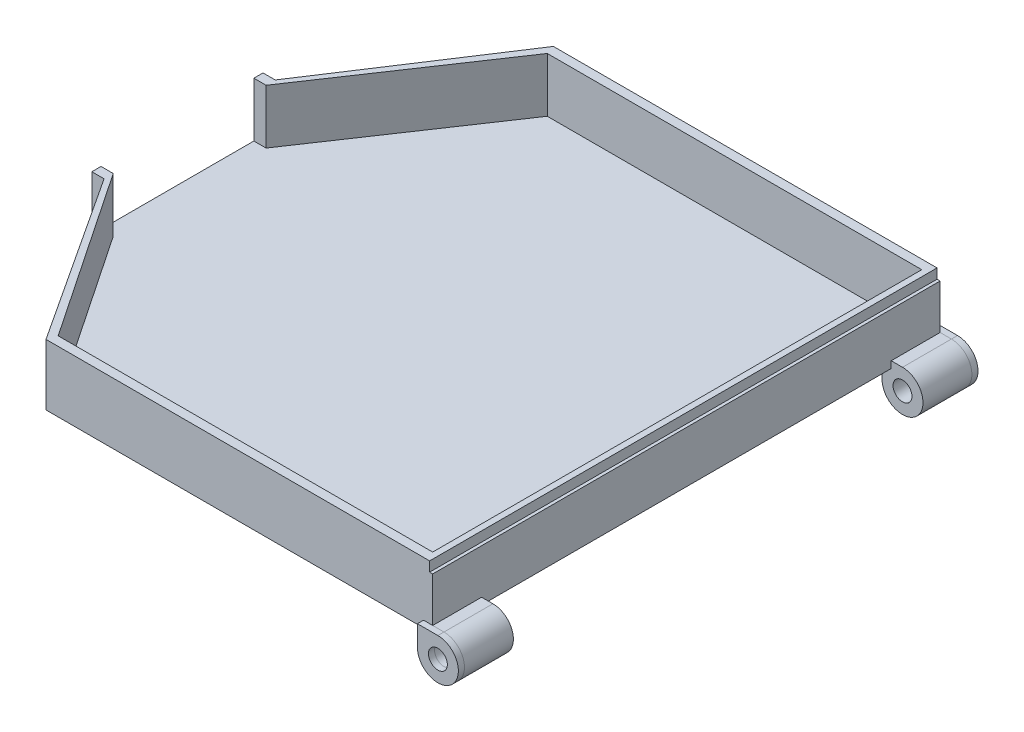
from build123d import *

# Parameters (mm, degrees)
SKETCH_2_R               = 1.55
EXTRUDE_1_DEPTH          = 83
SKETCH_3_W               = 79.752323104
SKETCH_3_H               = 1.5
EXTRUDE_2_DEPTH          = 8.9
EXTRUDE_2_2_DEPTH        = 8.9
EXTRUDE_3_DEPTH          = 8.9
CUT_EXTRUDE_2_DEPTH      = 9
CUT_EXTRUDE_2_DEPTH_BACK = 1.5
SKETCH_15_R              = 1.55
CUT_EXTRUDE_6_DEPTH      = 75
SKETCH_16_R              = 1.55
EXTRUDE_5_DEPTH          = 8
EXTRUDE_6_DEPTH          = 2
SKETCH_18_R              = 1.55
EXTRUDE_8_DEPTH          = 1
SKETCH_19_R              = 1.55
EXTRUDE_9_DEPTH          = 1


with BuildPart() as part:
    # Эскиз2 → Бобышка-Вытянуть1 (new body)
    with BuildSketch(Plane.XY):
        with BuildLine():
            Line((28.096955486, -1.101794634), (-25.790710178, -1.101794634))
            Line((-25.790710178, -1.101794634), (-31.655367618, -1.101794634))
            Line((-31.655367618, -1.101794634), (-51.655367618, -1.101794634))
            Line((-51.655367618, -1.101794634), (-51.655367618, -0.001794634))
            Line((-51.655367618, -0.001794634), (-31.655367618, -0.001794634))
            Line((-31.655367618, -0.001794634), (-29.655367618, -0.001794634))
            Line((-29.655367618, -0.001794634), (28.096955486, -0.001794634))
            Line((28.096955486, -0.001794634), (28.096955486, 8.898205366))
            Line((28.096955486, 8.898205366), (29.096955486, 8.898205366))
            Line((29.096955486, 8.898205366), (29.096955486, 7.298205366))
            Line((29.096955486, 7.298205366), (29.596955486, 7.298205366))
            Line((29.596955486, 7.298205366), (29.596955486, -0.001794634))
            Line((29.596955486, -0.001794634), (31.446955486, -0.001794634))
            ThreePointArc((31.446955486, -0.001794634), (33.815763203, -5.720602351), (28.096955486, -3.351794634))
            Line((28.096955486, -3.351794634), (28.096955486, -1.101794634))
        make_face()
        with Locations((31.446955486, -3.351794634)):
            Circle(SKETCH_2_R, mode=Mode.SUBTRACT)
    extrude(amount=EXTRUDE_1_DEPTH)



with BuildPart() as body_2:
    # Эскиз3 → Бобышка-Вытянуть2 (new body)
    with BuildSketch(Plane(origin=(0, -0.001794634, 0), x_dir=(1, 0, 0), z_dir=(0, 1, 0))):
        with Locations((-11.779206066, -0.75)):
            Rectangle(SKETCH_3_W, SKETCH_3_H)
    extrude(amount=EXTRUDE_2_DEPTH)


with BuildPart() as body_3:
    # Эскиз3 → Extrude 2 2 (new body)
    with BuildSketch(Plane(origin=(0, -0.001794634, 0), x_dir=(1, 0, 0), z_dir=(0, 1, 0))):
        with Locations((-11.779206066, -82.25)):
            Rectangle(SKETCH_3_W, SKETCH_3_H)
    extrude(amount=EXTRUDE_2_2_DEPTH)


with BuildPart() as part_1:
    add(part.part)

    add(body_2.part)  # Бобышка-Вытянуть3 merges body 2

    add(body_3.part)  # Бобышка-Вытянуть3 merges body 3
    # Эскиз5 → Бобышка-Вытянуть3 (add)
    with BuildSketch(Plane(origin=(0, -0.001794634, 0), x_dir=(1, 0, 0), z_dir=(0, 1, 0))):
        Polygon((-32.155367618, -83), (-51.655367618, -54), (-51.655367618, -55.5), (-33.655367618, -83), align=None)
        Polygon((-33.655367618, 0), (-51.655367618, -27.5), (-51.655367618, -29), (-32.155367618, 0), align=None)
    extrude(amount=EXTRUDE_3_DEPTH)

    # Эскиз7 → Вырез-Вытянуть2 (cut, two sides: drawn at the far end of the back side and taken through both)
    with BuildSketch(Plane(origin=(0, -0.001794634, 0), x_dir=(1, 0, 0), z_dir=(0, 1, 0)).offset(-CUT_EXTRUDE_2_DEPTH_BACK)):
        Polygon((-51.655367618, -27.5), (-51.655367618, 0), (-33.655367618, 0), (-34.637185799, -1.5), align=None)
        Polygon((-51.655367618, -55.5), (-34.637185799, -81.5), (-33.655367618, -83), (-51.655367618, -83), align=None)
    extrude(amount=CUT_EXTRUDE_2_DEPTH + CUT_EXTRUDE_2_DEPTH_BACK, mode=Mode.SUBTRACT)

    # Эскиз15 → Вырез-Вытянуть6 (cut)
    with BuildSketch(Plane.XY):
        with BuildLine():
            Line((31.446955486, -0.001794634), (29.596955486, -0.001794634))
            Line((29.596955486, -0.001794634), (29.596955486, -1.101794634))
            Line((29.596955486, -1.101794634), (28.096955486, -1.101794634))
            Line((28.096955486, -1.101794634), (28.096955486, -3.351794634))
            ThreePointArc((28.096955486, -3.351794634), (33.815763203, -5.720602351), (31.446955486, -0.001794634))
        make_face()
        with Locations((31.446955486, -3.351794634)):
            Circle(SKETCH_15_R, mode=Mode.SUBTRACT)
    extrude(amount=CUT_EXTRUDE_6_DEPTH, mode=Mode.SUBTRACT)

    # Эскиз16 → Бобышка-Вытянуть5 (add)
    with BuildSketch(Plane.XY):
        with BuildLine():
            Line((31.446955486, -0.001794634), (29.596955486, -0.001794634))
            Line((29.596955486, -0.001794634), (29.596955486, -1.101794634))
            Line((29.596955486, -1.101794634), (28.096955486, -1.101794634))
            Line((28.096955486, -1.101794634), (28.096955486, -3.351794634))
            ThreePointArc((28.096955486, -3.351794634), (33.815763203, -5.720602351), (31.446955486, -0.001794634))
        make_face()
        with Locations((31.446955486, -3.351794634)):
            Circle(SKETCH_16_R, mode=Mode.SUBTRACT)
    extrude(amount=EXTRUDE_5_DEPTH)

    # Эскиз17 → Бобышка-Вытянуть6 (add)
    with BuildSketch(Plane.ZY.offset(51.655367618)):
        Polygon((54, 8.898205366), (55.5, 8.898205366), (55.5, -1.101794634), (27.5, -1.101794634), (27.5, 8.898205366), (29, 8.898205366), (29, -0.001794634), (54, -0.001794634), align=None)
    extrude(amount=EXTRUDE_6_DEPTH)


with BuildPart() as body_2_2:
    # Эскиз18 → Бобышка-Вытянуть8 (new body)
    with BuildSketch(Plane.XY.offset(83)):
        with BuildLine():
            Line((31.446955486, -0.001794634), (28.096955486, -0.001794634))
            Line((28.096955486, -0.001794634), (28.096955486, -3.351794634))
            ThreePointArc((28.096955486, -3.351794634), (33.815763203, -5.720602351), (31.446955486, -0.001794634))
        make_face()
        with Locations((31.446955486, -3.351794634)):
            Circle(SKETCH_18_R, mode=Mode.SUBTRACT)
    extrude(amount=EXTRUDE_8_DEPTH)


with BuildPart() as body_3_2:
    # Эскиз19 → Бобышка-Вытянуть9 (new body)
    with BuildSketch(Plane(origin=(0, 0, 0), x_dir=(-1, 0, 0), z_dir=(0, 0, -1))):
        with BuildLine():
            Line((-31.446955486, -0.001794634), (-28.096955486, -0.001794634))
            Line((-28.096955486, -0.001794634), (-28.096955486, -3.351794634))
            ThreePointArc((-28.096955486, -3.351794634), (-33.815763203, -5.720602351), (-31.446955486, -0.001794634))
        make_face()
        with Locations((-31.446955486, -3.351794634)):
            Circle(SKETCH_19_R, mode=Mode.SUBTRACT)
    extrude(amount=EXTRUDE_9_DEPTH)


solid = Compound([part_1.part, body_2_2.part, body_3_2.part])
